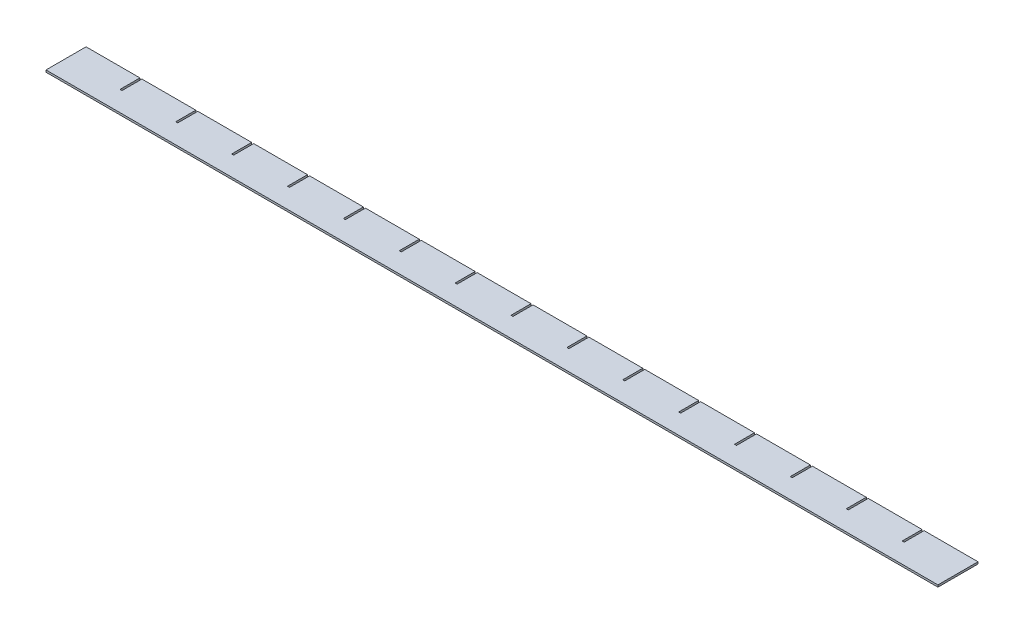
from build123d import *

# Parameters (mm, degrees)
SKETCH1_W           = 222.6
SKETCH1_H           = 10
BOSS_EXTRUDE1_DEPTH = 0.5
SKETCH2_W           = 0.5
SKETCH2_H           = 5
CUT_EXTRUDE1_DEPTH  = 0.5


with BuildPart() as part:
    # Sketch1 → Boss-Extrude1 (new body)
    with BuildSketch(Plane(origin=(0, 0, 0), x_dir=(1, 0, 0), z_dir=(0, 1, 0))):
        with Locations((111.3, 5)):
            Rectangle(SKETCH1_W, SKETCH1_H)
    extrude(amount=BOSS_EXTRUDE1_DEPTH)

    # Sketch2 → Cut-Extrude1 (cut)
    with BuildSketch(Plane(origin=(0, 0.5, 0), x_dir=(1, 0, 0), z_dir=(0, 1, 0))):
        with Locations((13.69375, 7.5)):
            Rectangle(SKETCH2_W, SKETCH2_H)
        with Locations((27.6375, 7.5)):
            Rectangle(SKETCH2_W, SKETCH2_H)
        with Locations((41.58125, 7.5)):
            Rectangle(SKETCH2_W, SKETCH2_H)
        with Locations((55.525, 7.5)):
            Rectangle(SKETCH2_W, SKETCH2_H)
        with Locations((69.46875, 7.5)):
            Rectangle(SKETCH2_W, SKETCH2_H)
        with Locations((83.4125, 7.5)):
            Rectangle(SKETCH2_W, SKETCH2_H)
        with Locations((97.35625, 7.5)):
            Rectangle(SKETCH2_W, SKETCH2_H)
        with Locations((111.3, 7.5)):
            Rectangle(SKETCH2_W, SKETCH2_H)
        with Locations((125.24375, 7.5)):
            Rectangle(SKETCH2_W, SKETCH2_H)
        with Locations((139.1875, 7.5)):
            Rectangle(SKETCH2_W, SKETCH2_H)
        with Locations((153.13125, 7.5)):
            Rectangle(SKETCH2_W, SKETCH2_H)
        with Locations((167.075, 7.5)):
            Rectangle(SKETCH2_W, SKETCH2_H)
        with Locations((181.01875, 7.5)):
            Rectangle(SKETCH2_W, SKETCH2_H)
        with Locations((194.9625, 7.5)):
            Rectangle(SKETCH2_W, SKETCH2_H)
        with Locations((208.90625, 7.5)):
            Rectangle(SKETCH2_W, SKETCH2_H)
    extrude(amount=-CUT_EXTRUDE1_DEPTH, mode=Mode.SUBTRACT)


solid = part.part
